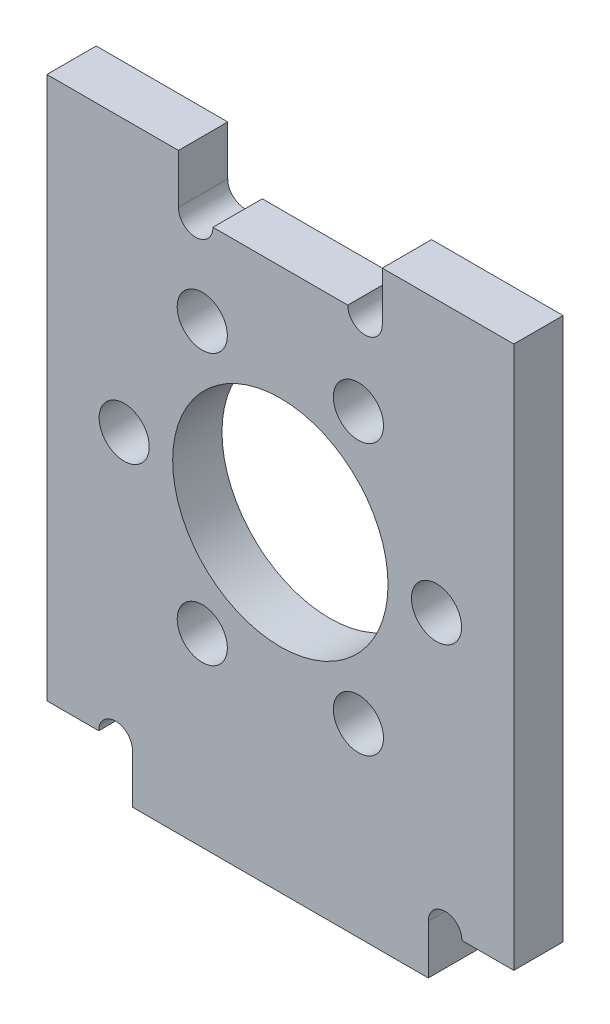
from build123d import *

# Parameters (mm, degrees)
SKETCH_1_W               = 28.4
SKETCH_1_H               = 30
EXTRUDE_1_DEPTH          = 3
SKETCH_2_R               = 6.55
CUT_EXTRUDE_1_DEPTH      = 3
SKETCH_3_R               = 1.525
CUT_EXTRUDE_2_DEPTH      = 3
PATTERN_CIRCULAR_1_COUNT = 6
SKETCH_4_W               = 8
SKETCH_4_H               = 3
EXTRUDE_2_DEPTH          = 3
SKETCH_5_R               = 1.05
CUT_EXTRUDE_3_DEPTH      = 3
SKETCH_6_W               = 18
SKETCH_6_H               = 6
EXTRUDE_3_DEPTH          = 3
SKETCH_7_R               = 1.025
CUT_EXTRUDE_4_DEPTH      = 3


with BuildPart() as part:
    # 草图1 → 凸台-拉伸1 (new body)
    with BuildSketch(Plane.XY):
        Rectangle(SKETCH_1_W, SKETCH_1_H)
    extrude(amount=EXTRUDE_1_DEPTH)

    # 草图2 → 切除-拉伸1 (cut)
    with BuildSketch(Plane.XY.offset(3)):
        with Locations((0, 1.5)):
            Circle(SKETCH_2_R)
    extrude(amount=-CUT_EXTRUDE_1_DEPTH, mode=Mode.SUBTRACT)

    # 草图3 → 切除-拉伸2 (cut)
    with BuildSketch(Plane.XY.offset(3)):
        with Locations((-9.5, 1.5)):
            Circle(SKETCH_3_R)
    cut_extrude_2 = extrude(amount=-CUT_EXTRUDE_2_DEPTH, mode=Mode.SUBTRACT)

    # 阵列(圆周)1: 切除-拉伸2 ×6 about axis
    pattern_circular_1_axis = Axis((0, 1.5, 0), (0, 0, 1))
    for i in range(1, PATTERN_CIRCULAR_1_COUNT):
        add(cut_extrude_2.rotate(pattern_circular_1_axis, i * 360 / PATTERN_CIRCULAR_1_COUNT), mode=Mode.SUBTRACT)

    # 草图4 → 凸台-拉伸2 (add)
    with BuildSketch(Plane(origin=(0, 0, 0), x_dir=(-1, 0, 0), z_dir=(0, 0, -1))):
        with Locations((-10.2, 16.5)):
            Rectangle(SKETCH_4_W, SKETCH_4_H)
        with Locations((10.2, 16.5)):
            Rectangle(SKETCH_4_W, SKETCH_4_H)
    extrude(amount=-EXTRUDE_2_DEPTH)

    # 草图5 → 切除-拉伸3 (cut)
    with BuildSketch(Plane.XY.offset(3)):
        with Locations((-5.15, 15)):
            Circle(SKETCH_5_R)
        with Locations((5.15, 15)):
            Circle(SKETCH_5_R)
    extrude(amount=-CUT_EXTRUDE_3_DEPTH, mode=Mode.SUBTRACT)

    # 草图6 → 凸台-拉伸3 (add)
    with BuildSketch(Plane(origin=(0, 0, 0), x_dir=(-1, 0, 0), z_dir=(0, 0, -1))):
        with Locations((0, -15)):
            Rectangle(SKETCH_6_W, SKETCH_6_H)
    extrude(amount=-EXTRUDE_3_DEPTH)

    # 草图7 → 切除-拉伸4 (cut)
    with BuildSketch(Plane(origin=(0, 0, 0), x_dir=(-1, 0, 0), z_dir=(0, 0, -1))):
        with Locations((10.025, -15)):
            Circle(SKETCH_7_R)
        with Locations((-10.025, -15)):
            Circle(SKETCH_7_R)
    extrude(amount=-CUT_EXTRUDE_4_DEPTH, mode=Mode.SUBTRACT)


solid = part.part
